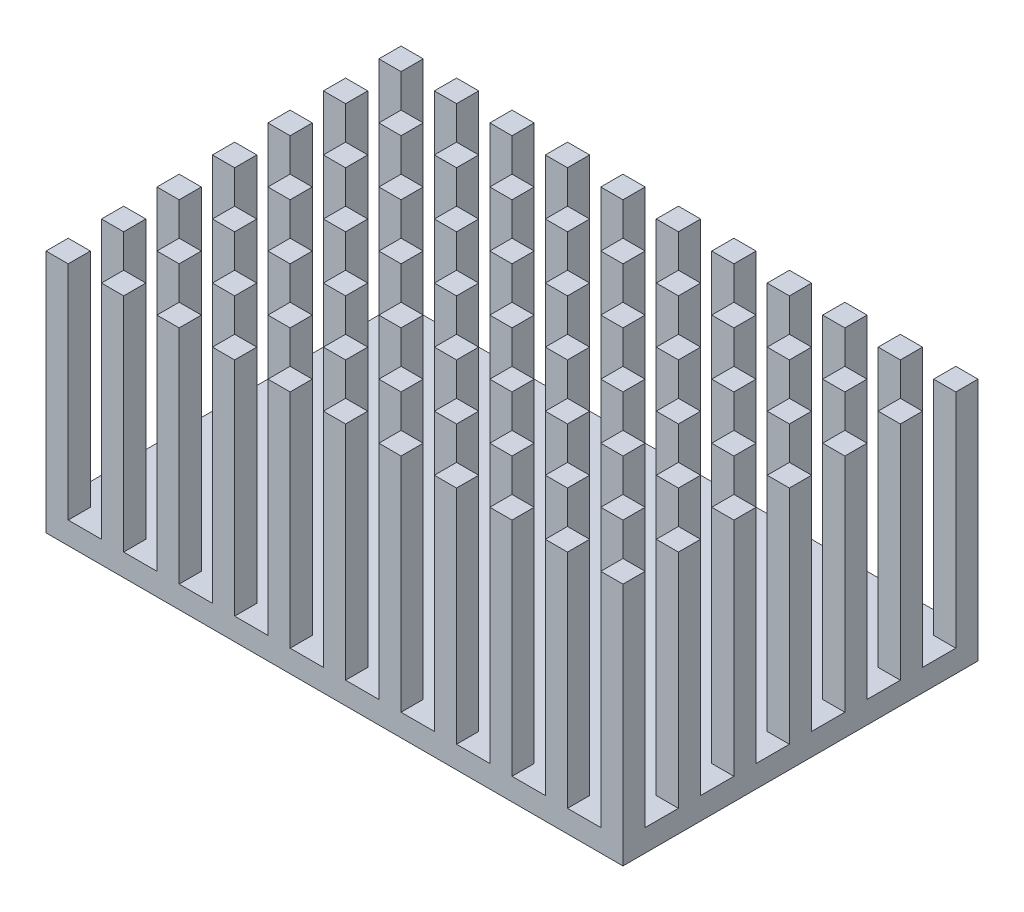
from build123d import *

# Parameters (mm, degrees)
SKETCH1_W           = 52
SKETCH1_H           = 32
BOSS_EXTRUDE1_DEPTH = 2
SKETCH2_W           = 2
SKETCH2_H           = 2
BOSS_EXTRUDE2_DEPTH = 20


with BuildPart() as part:
    # Sketch1 → Boss-Extrude1 (new body)
    with BuildSketch(Plane(origin=(0, 0, 0), x_dir=(1, 0, 0), z_dir=(0, 1, 0))):
        Rectangle(SKETCH1_W, SKETCH1_H)
    extrude(amount=BOSS_EXTRUDE1_DEPTH)

    # Sketch2 → Boss-Extrude2 (add)
    with BuildSketch(Plane(origin=(0, 2, 0), x_dir=(1, 0, 0), z_dir=(0, 1, 0))):
        with Locations((-20, 15)):
            Rectangle(SKETCH2_W, SKETCH2_H)
        with Locations((-25, 15)):
            Rectangle(SKETCH2_W, SKETCH2_H)
        with Locations((-15, 15)):
            Rectangle(SKETCH2_W, SKETCH2_H)
        with Locations((-10, 15)):
            Rectangle(SKETCH2_W, SKETCH2_H)
        with Locations((-5, 15)):
            Rectangle(SKETCH2_W, SKETCH2_H)
        with Locations((0, 15)):
            Rectangle(SKETCH2_W, SKETCH2_H)
        with Locations((5, 15)):
            Rectangle(SKETCH2_W, SKETCH2_H)
        with Locations((10, 15)):
            Rectangle(SKETCH2_W, SKETCH2_H)
        with Locations((15, 15)):
            Rectangle(SKETCH2_W, SKETCH2_H)
        with Locations((20, 15)):
            Rectangle(SKETCH2_W, SKETCH2_H)
        with Locations((25, 15)):
            Rectangle(SKETCH2_W, SKETCH2_H)
        with Locations((-20, 10)):
            Rectangle(SKETCH2_W, SKETCH2_H)
        with Locations((-15, 10)):
            Rectangle(SKETCH2_W, SKETCH2_H)
        with Locations((-10, 10)):
            Rectangle(SKETCH2_W, SKETCH2_H)
        with Locations((-5, 10)):
            Rectangle(SKETCH2_W, SKETCH2_H)
        with Locations((0, 10)):
            Rectangle(SKETCH2_W, SKETCH2_H)
        with Locations((5, 10)):
            Rectangle(SKETCH2_W, SKETCH2_H)
        with Locations((10, 10)):
            Rectangle(SKETCH2_W, SKETCH2_H)
        with Locations((15, 10)):
            Rectangle(SKETCH2_W, SKETCH2_H)
        with Locations((20, 10)):
            Rectangle(SKETCH2_W, SKETCH2_H)
        with Locations((25, 10)):
            Rectangle(SKETCH2_W, SKETCH2_H)
        with Locations((-20, 5)):
            Rectangle(SKETCH2_W, SKETCH2_H)
        with Locations((-15, 5)):
            Rectangle(SKETCH2_W, SKETCH2_H)
        with Locations((-10, 5)):
            Rectangle(SKETCH2_W, SKETCH2_H)
        with Locations((-5, 5)):
            Rectangle(SKETCH2_W, SKETCH2_H)
        with Locations((0, 5)):
            Rectangle(SKETCH2_W, SKETCH2_H)
        with Locations((5, 5)):
            Rectangle(SKETCH2_W, SKETCH2_H)
        with Locations((10, 5)):
            Rectangle(SKETCH2_W, SKETCH2_H)
        with Locations((15, 5)):
            Rectangle(SKETCH2_W, SKETCH2_H)
        with Locations((20, 5)):
            Rectangle(SKETCH2_W, SKETCH2_H)
        with Locations((25, 5)):
            Rectangle(SKETCH2_W, SKETCH2_H)
        with Locations((-20, 0)):
            Rectangle(SKETCH2_W, SKETCH2_H)
        with Locations((-15, 0)):
            Rectangle(SKETCH2_W, SKETCH2_H)
        with Locations((-10, 0)):
            Rectangle(SKETCH2_W, SKETCH2_H)
        with Locations((-5, 0)):
            Rectangle(SKETCH2_W, SKETCH2_H)
        Rectangle(SKETCH2_W, SKETCH2_H)
        with Locations((5, 0)):
            Rectangle(SKETCH2_W, SKETCH2_H)
        with Locations((10, 0)):
            Rectangle(SKETCH2_W, SKETCH2_H)
        with Locations((15, 0)):
            Rectangle(SKETCH2_W, SKETCH2_H)
        with Locations((20, 0)):
            Rectangle(SKETCH2_W, SKETCH2_H)
        with Locations((25, 0)):
            Rectangle(SKETCH2_W, SKETCH2_H)
        with Locations((-20, -5)):
            Rectangle(SKETCH2_W, SKETCH2_H)
        with Locations((-15, -5)):
            Rectangle(SKETCH2_W, SKETCH2_H)
        with Locations((-10, -5)):
            Rectangle(SKETCH2_W, SKETCH2_H)
        with Locations((-5, -5)):
            Rectangle(SKETCH2_W, SKETCH2_H)
        with Locations((0, -5)):
            Rectangle(SKETCH2_W, SKETCH2_H)
        with Locations((5, -5)):
            Rectangle(SKETCH2_W, SKETCH2_H)
        with Locations((10, -5)):
            Rectangle(SKETCH2_W, SKETCH2_H)
        with Locations((15, -5)):
            Rectangle(SKETCH2_W, SKETCH2_H)
        with Locations((20, -5)):
            Rectangle(SKETCH2_W, SKETCH2_H)
        with Locations((25, -5)):
            Rectangle(SKETCH2_W, SKETCH2_H)
        with Locations((-20, -10)):
            Rectangle(SKETCH2_W, SKETCH2_H)
        with Locations((-15, -10)):
            Rectangle(SKETCH2_W, SKETCH2_H)
        with Locations((-10, -10)):
            Rectangle(SKETCH2_W, SKETCH2_H)
        with Locations((-5, -10)):
            Rectangle(SKETCH2_W, SKETCH2_H)
        with Locations((0, -10)):
            Rectangle(SKETCH2_W, SKETCH2_H)
        with Locations((5, -10)):
            Rectangle(SKETCH2_W, SKETCH2_H)
        with Locations((10, -10)):
            Rectangle(SKETCH2_W, SKETCH2_H)
        with Locations((15, -10)):
            Rectangle(SKETCH2_W, SKETCH2_H)
        with Locations((20, -10)):
            Rectangle(SKETCH2_W, SKETCH2_H)
        with Locations((25, -10)):
            Rectangle(SKETCH2_W, SKETCH2_H)
        with Locations((-20, -15)):
            Rectangle(SKETCH2_W, SKETCH2_H)
        with Locations((-15, -15)):
            Rectangle(SKETCH2_W, SKETCH2_H)
        with Locations((-10, -15)):
            Rectangle(SKETCH2_W, SKETCH2_H)
        with Locations((-5, -15)):
            Rectangle(SKETCH2_W, SKETCH2_H)
        with Locations((0, -15)):
            Rectangle(SKETCH2_W, SKETCH2_H)
        with Locations((5, -15)):
            Rectangle(SKETCH2_W, SKETCH2_H)
        with Locations((10, -15)):
            Rectangle(SKETCH2_W, SKETCH2_H)
        with Locations((15, -15)):
            Rectangle(SKETCH2_W, SKETCH2_H)
        with Locations((20, -15)):
            Rectangle(SKETCH2_W, SKETCH2_H)
        with Locations((25, -15)):
            Rectangle(SKETCH2_W, SKETCH2_H)
        with Locations((-25, 10)):
            Rectangle(SKETCH2_W, SKETCH2_H)
        with Locations((-25, 5)):
            Rectangle(SKETCH2_W, SKETCH2_H)
        with Locations((-25, 0)):
            Rectangle(SKETCH2_W, SKETCH2_H)
        with Locations((-25, -5)):
            Rectangle(SKETCH2_W, SKETCH2_H)
        with Locations((-25, -10)):
            Rectangle(SKETCH2_W, SKETCH2_H)
        with Locations((-25, -15)):
            Rectangle(SKETCH2_W, SKETCH2_H)
    extrude(amount=BOSS_EXTRUDE2_DEPTH)


solid = part.part
